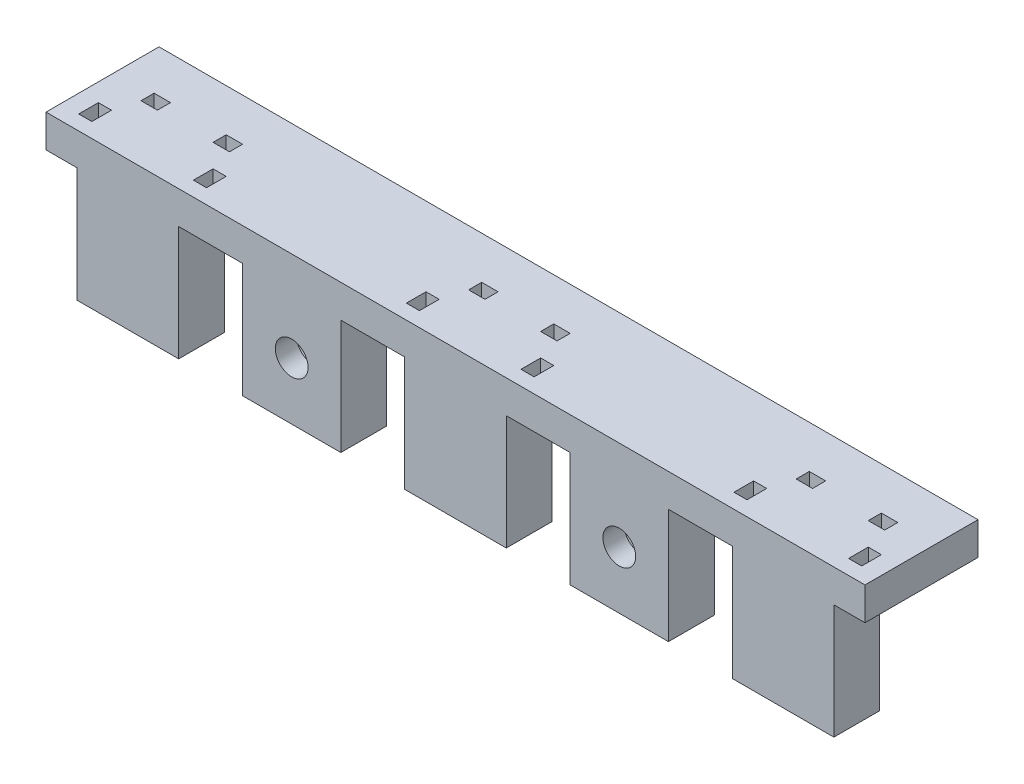
from build123d import *

# Parameters (mm, degrees)
SKETCH_1_W             = 117.567875581
SKETCH_1_H             = 35.211732604
EXTRUDE_1_DEPTH        = 2
SKETCH_3_W             = 0.8
SKETCH_3_H             = 1.2
SKETCH_3_W_2           = 1
SKETCH_3_H_2           = 0.8
CUT_EXTRUDE_1_DEPTH    = 123.743926455
PATTERN_LINEAR_1_COUNT = 3
PATTERN_LINEAR_1_PITCH = 20
SKETCH_4_OUTSIDE_W     = 144.116
SKETCH_4_OUTSIDE_H     = 61.76
SKETCH_4_OUTSIDE_W_2   = 50
SKETCH_4_OUTSIDE_H_2   = 6.9
CUT_EXTRUDE_2_DEPTH    = 123.743926455
SKETCH_5_W             = 6.2
SKETCH_5_H             = 2.8
SKETCH_5_W_2           = 6
EXTRUDE_2_DEPTH        = 7
SKETCH_6_R             = 2
CUT_EXTRUDE_3_DEPTH    = 1.5
SKETCH_6_3_R           = 1
CUT_EXTRUDE_4_DEPTH    = 51.653825127


with BuildPart() as part:
    # 草图1 → 凸台-拉伸1 (new body)
    with BuildSketch(Plane(origin=(0, 0, 0), x_dir=(1, 0, 0), z_dir=(0, 1, 0))):
        with Locations((58.783937791, -17.605866302)):
            Rectangle(SKETCH_1_W, SKETCH_1_H)
    extrude(amount=EXTRUDE_1_DEPTH)

    # 草图3 → 切除-拉伸1 (cut, through all)
    with BuildSketch(Plane(origin=(0, 2, 0), x_dir=(1, 0, 0), z_dir=(0, 1, 0))):
        with Locations((1.5, -5.4)):
            Rectangle(SKETCH_3_W, SKETCH_3_H)
        with Locations((8.5, -5.4)):
            Rectangle(SKETCH_3_W, SKETCH_3_H)
        with Locations((2.8, -3)):
            Rectangle(SKETCH_3_W_2, SKETCH_3_H_2)
        with Locations((7.2, -3)):
            Rectangle(SKETCH_3_W_2, SKETCH_3_H_2)
    cut_extrude_1 = extrude(amount=-CUT_EXTRUDE_1_DEPTH, mode=Mode.SUBTRACT)

    # 阵列(线性)1: 切除-拉伸1 ×3
    with Locations(*[(i * PATTERN_LINEAR_1_PITCH, 0, 0) for i in range(1, PATTERN_LINEAR_1_COUNT)]):
        add(cut_extrude_1, mode=Mode.SUBTRACT)

    # 草图4 outside → 切除-拉伸2 (cut, through all)
    with BuildSketch(Plane.XZ):
        with Locations((58.784, 17.606)):
            Rectangle(SKETCH_4_OUTSIDE_W, SKETCH_4_OUTSIDE_H)
        with Locations((25, 3.45)):
            Rectangle(SKETCH_4_OUTSIDE_W_2, SKETCH_4_OUTSIDE_H_2, mode=Mode.SUBTRACT)
    extrude(amount=-CUT_EXTRUDE_2_DEPTH, mode=Mode.SUBTRACT)

    # 草图5 → 凸台-拉伸2 (add)
    with BuildSketch(Plane.XZ):
        with Locations((45, 5.5)):
            Rectangle(SKETCH_5_W, SKETCH_5_H)
        with Locations((25, 5.5)):
            Rectangle(SKETCH_5_W, SKETCH_5_H)
        with Locations((5, 5.5)):
            Rectangle(SKETCH_5_W, SKETCH_5_H)
        with Locations((15, 5.5)):
            Rectangle(SKETCH_5_W_2, SKETCH_5_H)
        with Locations((35, 5.5)):
            Rectangle(SKETCH_5_W_2, SKETCH_5_H)
    extrude(amount=EXTRUDE_2_DEPTH)

    # 草图6 → 切除-拉伸3 (cut)
    with BuildSketch(Plane(origin=(0, 0, 4.1), x_dir=(-1, 0, 0), z_dir=(0, 0, -1))):
        with Locations((-35, -3.5)):
            Circle(SKETCH_6_R)
        with Locations((-15, -3.5)):
            Circle(SKETCH_6_R)
    extrude(amount=-CUT_EXTRUDE_3_DEPTH, mode=Mode.SUBTRACT)

    # 草图6<3> → 切除-拉伸4 (cut, through all)
    with BuildSketch(Plane(origin=(0, 0, 4.1), x_dir=(-1, 0, 0), z_dir=(0, 0, -1))):
        with Locations((-35, -3.5)):
            Circle(SKETCH_6_3_R)
        with Locations((-15, -3.5)):
            Circle(SKETCH_6_3_R)
    extrude(amount=-CUT_EXTRUDE_4_DEPTH, mode=Mode.SUBTRACT)


solid = part.part
